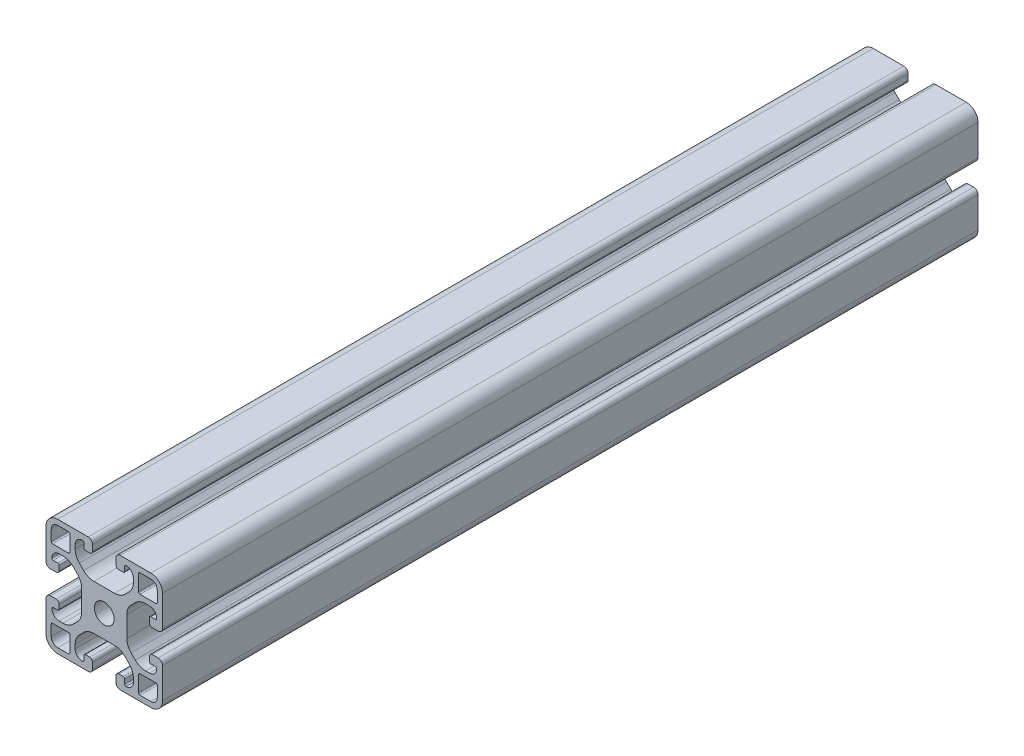
from build123d import *

# Parameters (mm, degrees)
ESQUISSE1_R        = 3.4
BOSS_EXTRU_1_DEPTH = 280


with BuildPart() as part:
    # Esquisse1 → Boss.-Extru.1 (new body)
    with BuildSketch(Plane(origin=(0, 0, -30), x_dir=(-1, 0, 0), z_dir=(0, 0, -1))):
        with BuildLine():
            Line((-4.5, 15), (-4.5, 13.5))
            ThreePointArc((-4.5, 13.5), (-4.353553391, 13.146446609), (-4, 13))
            Line((-4, 13), (-2.5, 13))
            ThreePointArc((-2.5, 13), (-2.146446609, 12.853553391), (-2, 12.5))
            ThreePointArc((-2, 12.5), (-2.732233047, 10.732233047), (-4.5, 10))
            Line((-4.5, 10), (-5.807611845, 10))
            ThreePointArc((-5.807611845, 10), (-7.721029006, 10.380602337), (-9.343145751, 11.464466094))
            Line((-9.343145751, 11.464466094), (-10.785533906, 12.906854249))
            ThreePointArc((-10.785533906, 12.906854249), (-11.869397663, 14.528970994), (-12.25, 16.442388155))
            Line((-12.25, 16.442388155), (-12.25, 23.557611845))
            ThreePointArc((-12.25, 23.557611845), (-11.869397663, 25.471029006), (-10.785533906, 27.093145751))
            Line((-10.785533906, 27.093145751), (-9.343145751, 28.535533906))
            ThreePointArc((-9.343145751, 28.535533906), (-7.721029006, 29.619397663), (-5.807611845, 30))
            Line((-5.807611845, 30), (-4.5, 30))
            ThreePointArc((-4.5, 30), (-2.732233047, 29.267766953), (-2, 27.5))
            ThreePointArc((-2, 27.5), (-2.146446609, 27.146446609), (-2.5, 27))
            Line((-2.5, 27), (-4, 27))
            ThreePointArc((-4, 27), (-4.353553391, 26.853553391), (-4.5, 26.5))
            Line((-4.5, 26.5), (-4.5, 25))
            ThreePointArc((-4.5, 25), (-4.207106781, 24.292893219), (-3.5, 24))
            Line((-3.5, 24), (-1.5, 24))
            ThreePointArc((-1.5, 24), (-0.439339828, 24.439339828), (0, 25.5))
            Line((0, 25.5), (0, 36))
            ThreePointArc((0, 36), (-1.171572875, 38.828427125), (-4, 40))
            Line((-4, 40), (-14.5, 40))
            ThreePointArc((-14.5, 40), (-15.560660172, 39.560660172), (-16, 38.5))
            Line((-16, 38.5), (-16, 36.5))
            ThreePointArc((-16, 36.5), (-15.707106781, 35.792893219), (-15, 35.5))
            Line((-15, 35.5), (-13.5, 35.5))
            ThreePointArc((-13.5, 35.5), (-13.146446609, 35.646446609), (-13, 36))
            Line((-13, 36), (-13, 37.5))
            ThreePointArc((-13, 37.5), (-12.853553391, 37.853553391), (-12.5, 38))
            ThreePointArc((-12.5, 38), (-10.732233047, 37.267766953), (-10, 35.5))
            Line((-10, 35.5), (-10, 34.192388155))
            ThreePointArc((-10, 34.192388155), (-10.380602337, 32.278970994), (-11.464466094, 30.656854249))
            Line((-11.464466094, 30.656854249), (-12.906854249, 29.214466094))
            ThreePointArc((-12.906854249, 29.214466094), (-14.528970994, 28.130602337), (-16.442388155, 27.75))
            Line((-16.442388155, 27.75), (-23.557611845, 27.75))
            ThreePointArc((-23.557611845, 27.75), (-25.471029006, 28.130602337), (-27.093145751, 29.214466094))
            Line((-27.093145751, 29.214466094), (-28.535533906, 30.656854249))
            ThreePointArc((-28.535533906, 30.656854249), (-29.619397663, 32.278970994), (-30, 34.192388155))
            Line((-30, 34.192388155), (-30, 35.5))
            ThreePointArc((-30, 35.5), (-29.267766953, 37.267766953), (-27.5, 38))
            ThreePointArc((-27.5, 38), (-27.146446609, 37.853553391), (-27, 37.5))
            Line((-27, 37.5), (-27, 36))
            ThreePointArc((-27, 36), (-26.853553391, 35.646446609), (-26.5, 35.5))
            Line((-26.5, 35.5), (-25, 35.5))
            ThreePointArc((-25, 35.5), (-24.292893219, 35.792893219), (-24, 36.5))
            Line((-24, 36.5), (-24, 38.5))
            ThreePointArc((-24, 38.5), (-24.439339828, 39.560660172), (-25.5, 40))
            Line((-25.5, 40), (-36, 40))
            ThreePointArc((-36, 40), (-38.828427125, 38.828427125), (-40, 36))
            Line((-40, 36), (-40, 25.5))
            ThreePointArc((-40, 25.5), (-39.560660172, 24.439339828), (-38.5, 24))
            Line((-38.5, 24), (-36.5, 24))
            ThreePointArc((-36.5, 24), (-35.792893219, 24.292893219), (-35.5, 25))
            Line((-35.5, 25), (-35.5, 26.5))
            ThreePointArc((-35.5, 26.5), (-35.646446609, 26.853553391), (-36, 27))
            Line((-36, 27), (-37.5, 27))
            ThreePointArc((-37.5, 27), (-37.853553391, 27.146446609), (-38, 27.5))
            ThreePointArc((-38, 27.5), (-37.267766953, 29.267766953), (-35.5, 30))
            Line((-35.5, 30), (-34.192388155, 30))
            ThreePointArc((-34.192388155, 30), (-32.278970994, 29.619397663), (-30.656854249, 28.535533906))
            Line((-30.656854249, 28.535533906), (-29.214466094, 27.093145751))
            ThreePointArc((-29.214466094, 27.093145751), (-28.130602337, 25.471029006), (-27.75, 23.557611845))
            Line((-27.75, 23.557611845), (-27.75, 16.442388155))
            ThreePointArc((-27.75, 16.442388155), (-28.130602337, 14.528970994), (-29.214466094, 12.906854249))
            Line((-29.214466094, 12.906854249), (-30.656854249, 11.464466094))
            ThreePointArc((-30.656854249, 11.464466094), (-32.278970994, 10.380602337), (-34.192388155, 10))
            Line((-34.192388155, 10), (-35.5, 10))
            ThreePointArc((-35.5, 10), (-37.267766953, 10.732233047), (-38, 12.5))
            ThreePointArc((-38, 12.5), (-37.853553391, 12.853553391), (-37.5, 13))
            Line((-37.5, 13), (-36, 13))
            ThreePointArc((-36, 13), (-35.646446609, 13.146446609), (-35.5, 13.5))
            Line((-35.5, 13.5), (-35.5, 15))
            ThreePointArc((-35.5, 15), (-35.792893219, 15.707106781), (-36.5, 16))
            Line((-36.5, 16), (-38.5, 16))
            ThreePointArc((-38.5, 16), (-39.560660172, 15.560660172), (-40, 14.5))
            Line((-40, 14.5), (-40, 4))
            ThreePointArc((-40, 4), (-38.828427125, 1.171572875), (-36, 0))
            Line((-36, 0), (-25.5, 0))
            ThreePointArc((-25.5, 0), (-24.439339828, 0.439339828), (-24, 1.5))
            Line((-24, 1.5), (-24, 3.5))
            ThreePointArc((-24, 3.5), (-24.292893219, 4.207106781), (-25, 4.5))
            Line((-25, 4.5), (-26.5, 4.5))
            ThreePointArc((-26.5, 4.5), (-26.853553391, 4.353553391), (-27, 4))
            Line((-27, 4), (-27, 2.5))
            ThreePointArc((-27, 2.5), (-27.146446609, 2.146446609), (-27.5, 2))
            ThreePointArc((-27.5, 2), (-29.267766953, 2.732233047), (-30, 4.5))
            Line((-30, 4.5), (-30, 5.807611845))
            ThreePointArc((-30, 5.807611845), (-29.619397663, 7.721029006), (-28.535533906, 9.343145751))
            Line((-28.535533906, 9.343145751), (-27.093145751, 10.785533906))
            ThreePointArc((-27.093145751, 10.785533906), (-25.471029006, 11.869397663), (-23.557611845, 12.25))
            Line((-23.557611845, 12.25), (-16.442388155, 12.25))
            ThreePointArc((-16.442388155, 12.25), (-14.528970994, 11.869397663), (-12.906854249, 10.785533906))
            Line((-12.906854249, 10.785533906), (-11.464466094, 9.343145751))
            ThreePointArc((-11.464466094, 9.343145751), (-10.380602337, 7.721029006), (-10, 5.807611845))
            Line((-10, 5.807611845), (-10, 4.5))
            ThreePointArc((-10, 4.5), (-10.732233047, 2.732233047), (-12.5, 2))
            ThreePointArc((-12.5, 2), (-12.853553391, 2.146446609), (-13, 2.5))
            Line((-13, 2.5), (-13, 4))
            ThreePointArc((-13, 4), (-13.146446609, 4.353553391), (-13.5, 4.5))
            Line((-13.5, 4.5), (-15, 4.5))
            ThreePointArc((-15, 4.5), (-15.707106781, 4.207106781), (-16, 3.5))
            Line((-16, 3.5), (-16, 1.5))
            ThreePointArc((-16, 1.5), (-15.560660172, 0.439339828), (-14.5, 0))
            Line((-14.5, 0), (-4, 0))
            ThreePointArc((-4, 0), (-1.171572875, 1.171572875), (0, 4))
            Line((0, 4), (0, 14.5))
            ThreePointArc((0, 14.5), (-0.439339828, 15.560660172), (-1.5, 16))
            Line((-1.5, 16), (-3.5, 16))
            ThreePointArc((-3.5, 16), (-4.207106781, 15.707106781), (-4.5, 15))
        make_face()
        with Locations(Location((-20, 20, 0), (0, 0, 180))):
            Circle(ESQUISSE1_R, mode=Mode.SUBTRACT)
        with BuildLine():
            Line((-4, 1.8), (-7.7, 1.8))
            ThreePointArc((-7.7, 1.8), (-8.053553391, 1.946446609), (-8.2, 2.3))
            Line((-8.2, 2.3), (-8.2, 7.7))
            ThreePointArc((-8.2, 7.7), (-8.053553391, 8.053553391), (-7.7, 8.2))
            Line((-7.7, 8.2), (-2.3, 8.2))
            ThreePointArc((-2.3, 8.2), (-1.946446609, 8.053553391), (-1.8, 7.7))
            Line((-1.8, 7.7), (-1.8, 4))
            ThreePointArc((-1.8, 4), (-2.444365081, 2.444365081), (-4, 1.8))
        make_face(mode=Mode.SUBTRACT)
        with BuildLine():
            Line((-38.2, 4), (-38.2, 7.7))
            ThreePointArc((-38.2, 7.7), (-38.053553391, 8.053553391), (-37.7, 8.2))
            Line((-37.7, 8.2), (-32.3, 8.2))
            ThreePointArc((-32.3, 8.2), (-31.946446609, 8.053553391), (-31.8, 7.7))
            Line((-31.8, 7.7), (-31.8, 2.3))
            ThreePointArc((-31.8, 2.3), (-31.946446609, 1.946446609), (-32.3, 1.8))
            Line((-32.3, 1.8), (-36, 1.8))
            ThreePointArc((-36, 1.8), (-37.555634919, 2.444365081), (-38.2, 4))
        make_face(mode=Mode.SUBTRACT)
        with BuildLine():
            Line((-36, 38.2), (-32.3, 38.2))
            ThreePointArc((-32.3, 38.2), (-31.946446609, 38.053553391), (-31.8, 37.7))
            Line((-31.8, 37.7), (-31.8, 32.3))
            ThreePointArc((-31.8, 32.3), (-31.946446609, 31.946446609), (-32.3, 31.8))
            Line((-32.3, 31.8), (-37.7, 31.8))
            ThreePointArc((-37.7, 31.8), (-38.053553391, 31.946446609), (-38.2, 32.3))
            Line((-38.2, 32.3), (-38.2, 36))
            ThreePointArc((-38.2, 36), (-37.555634919, 37.555634919), (-36, 38.2))
        make_face(mode=Mode.SUBTRACT)
        with BuildLine():
            Line((-1.8, 36), (-1.8, 32.3))
            ThreePointArc((-1.8, 32.3), (-1.946446609, 31.946446609), (-2.3, 31.8))
            Line((-2.3, 31.8), (-7.7, 31.8))
            ThreePointArc((-7.7, 31.8), (-8.053553391, 31.946446609), (-8.2, 32.3))
            Line((-8.2, 32.3), (-8.2, 37.7))
            ThreePointArc((-8.2, 37.7), (-8.053553391, 38.053553391), (-7.7, 38.2))
            Line((-7.7, 38.2), (-4, 38.2))
            ThreePointArc((-4, 38.2), (-2.444365081, 37.555634919), (-1.8, 36))
        make_face(mode=Mode.SUBTRACT)
    extrude(amount=-BOSS_EXTRU_1_DEPTH)


solid = part.part
